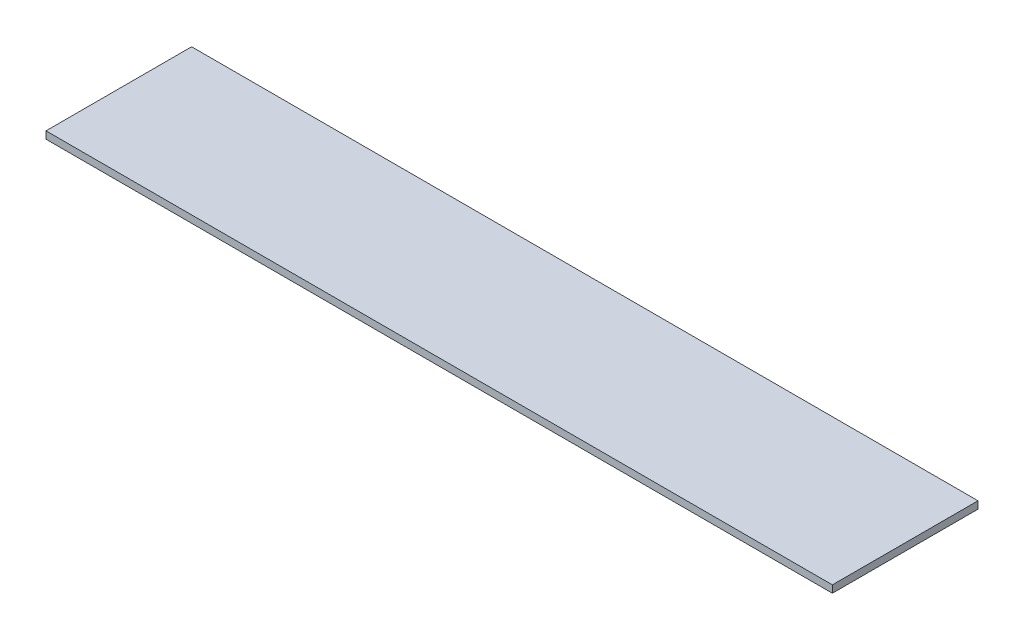
from build123d import *

# Parameters (mm, degrees)
SKETCH1_W      = 2743.2
SKETCH1_H      = 508
EXTRUDE1_DEPTH = 25.4


with BuildPart() as part:
    # Sketch1 → Extrude1 (new body)
    with BuildSketch(Plane(origin=(0, 0, 0), x_dir=(1, 0, 0), z_dir=(0, 1, 0))):
        with Locations((1371.6, 0)):
            Rectangle(SKETCH1_W, SKETCH1_H)
    extrude(amount=EXTRUDE1_DEPTH)


solid = part.part
